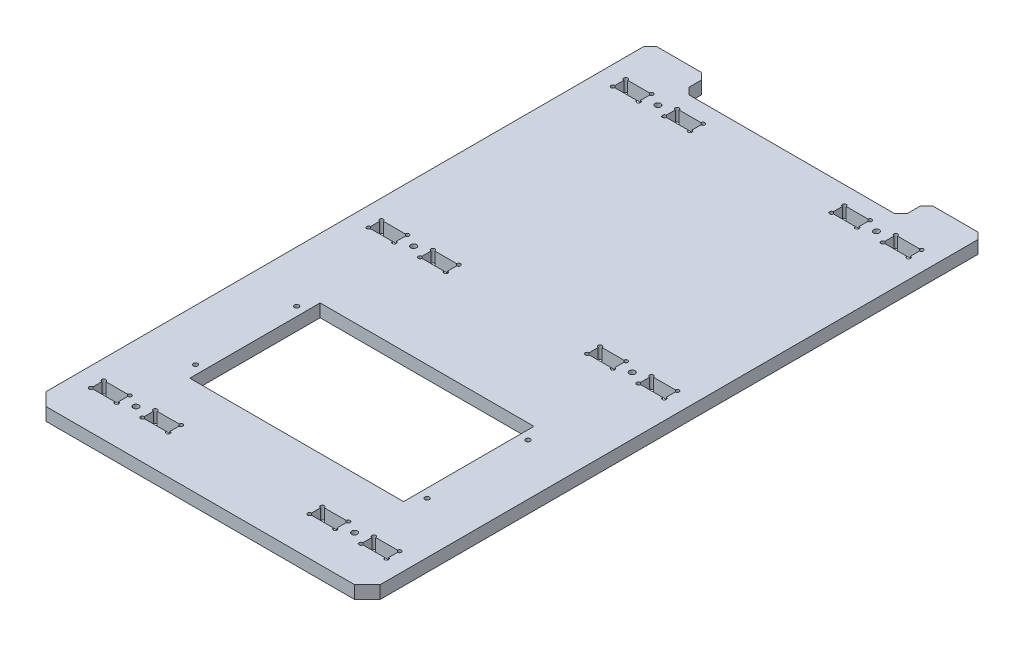
from build123d import *

# Parameters (mm, degrees)
SKETCH1_W            = 260
SKETCH1_H            = 440
EXTRUDE1_DEPTH       = 10
SKETCH3_W            = 260
SKETCH3_H            = 40
EXTRUDE3_DEPTH       = 10
SKETCH4_W            = 20
SKETCH4_H            = 10
CUT_EXTRUDE1_DEPTH   = 10
EXTRUDE4_DEPTH       = 10
MIRROR2_COPY_1_DEPTH = 10
MIRROR3_COPY_1_DEPTH = 10
MIRROR3_COPY_2_DEPTH = 10
MIRROR3_COPY_3_DEPTH = 10
MIRROR4_COPY_1_DEPTH = 10
MIRROR4_COPY_2_DEPTH = 10
MIRROR4_COPY_3_DEPTH = 10
M4_CLEARANCE_HOLE1_D = 4.5
SKETCH8_W            = 166.3
SKETCH8_H            = 101.4
CUT_EXTRUDE2_DEPTH   = 10
SKETCH9_R            = 1.75
CUT_EXTRUDE3_DEPTH   = 10
CHAMFER1_SIZE        = 10
SKETCH10_W           = 170
SKETCH10_H           = 20
EXTRUDE6_DEPTH       = 10
CHAMFER2_SIZE        = 5


with BuildPart() as part:
    # Sketch1 → Extrude1 (new body)
    with BuildSketch(Plane(origin=(0, 0, 0), x_dir=(1, 0, 0), z_dir=(0, 1, 0))):
        Rectangle(SKETCH1_W, SKETCH1_H)
    extrude(amount=EXTRUDE1_DEPTH)

    # Sketch3 → Extrude3 (add)
    with BuildSketch(Plane(origin=(0, 10, 0), x_dir=(1, 0, 0), z_dir=(0, 1, 0))):
        with Locations((0, 240)):
            Rectangle(SKETCH3_W, SKETCH3_H)
    extrude(amount=-EXTRUDE3_DEPTH)

    # Sketch4 → Cut-Extrude1 (cut)
    with BuildSketch(Plane(origin=(130, 0, -206), x_dir=(1, 0, 0), z_dir=(0, -1, 0))):
        with Locations((-235, 391)):
            Rectangle(SKETCH4_W, SKETCH4_H)
        with Locations((-195, 391)):
            Rectangle(SKETCH4_W, SKETCH4_H)
        with Locations((-65, 391)):
            Rectangle(SKETCH4_W, SKETCH4_H)
        with Locations((-25, 391)):
            Rectangle(SKETCH4_W, SKETCH4_H)
        with Locations((-235, 175)):
            Rectangle(SKETCH4_W, SKETCH4_H)
        with Locations((-195, 175)):
            Rectangle(SKETCH4_W, SKETCH4_H)
        with Locations((-65, 175)):
            Rectangle(SKETCH4_W, SKETCH4_H)
        with Locations((-25, 175)):
            Rectangle(SKETCH4_W, SKETCH4_H)
        with Locations((-235, -15)):
            Rectangle(SKETCH4_W, SKETCH4_H)
        with Locations((-195, -15)):
            Rectangle(SKETCH4_W, SKETCH4_H)
        with Locations((-65, -15)):
            Rectangle(SKETCH4_W, SKETCH4_H)
        with Locations((-25, -15)):
            Rectangle(SKETCH4_W, SKETCH4_H)
    extrude(amount=-CUT_EXTRUDE1_DEPTH, mode=Mode.SUBTRACT)

    # Sketch5 → Extrude4 (cut)
    with BuildSketch(Plane(origin=(0, 0, 0), x_dir=(-1, 0, 0), z_dir=(0, -1, 0))):
        with BuildLine():
            Line((96.5, -190), (95, -190))
            Line((95, -190), (95, -188.5))
            ThreePointArc((95, -188.5), (93.939339828, -191.060660172), (96.5, -190))
        make_face()
        with BuildLine():
            Line((115, -190), (113.5, -190))
            ThreePointArc((113.5, -190), (116.060660172, -191.060660172), (115, -188.5))
            Line((115, -188.5), (115, -190))
        make_face()
        with BuildLine():
            Line((115, -180), (113.5, -180))
            ThreePointArc((113.5, -180), (116.060660172, -178.939339828), (115, -181.5))
            Line((115, -181.5), (115, -180))
        make_face()
        with BuildLine():
            Line((96.5, -180), (95, -180))
            Line((95, -180), (95, -181.5))
            ThreePointArc((95, -181.5), (93.939339828, -178.939339828), (96.5, -180))
        make_face()
    extrude4 = extrude(amount=-EXTRUDE4_DEPTH, mode=Mode.SUBTRACT)

    # Mirror1: Extrude4 across plane
    add(extrude4.mirror(Plane(origin=(-85, 0, 0), x_dir=(0, 0, 1), z_dir=(1, 0, 0))), mode=Mode.SUBTRACT)

    # Mirror2: Extrude4 across plane
    add(extrude4.mirror(Plane(origin=(0, 0, 0), x_dir=(0, 0, 1), z_dir=(1, 0, 0))), mode=Mode.SUBTRACT)

    # Mirror2 copy 1 sketch → Mirror2 copy 1 (cut)
    with BuildSketch(Plane(origin=(170, 0, 0), x_dir=(-1, 0, 0), z_dir=(0, -1, 0))):
        with BuildLine():
            Line((96.5, -190), (95, -190))
            Line((95, -190), (95, -188.5))
            ThreePointArc((95, -188.5), (93.939339828, -191.060660172), (96.5, -190))
        make_face()
        with BuildLine():
            Line((115, -190), (113.5, -190))
            ThreePointArc((113.5, -190), (116.060660172, -191.060660172), (115, -188.5))
            Line((115, -188.5), (115, -190))
        make_face()
        with BuildLine():
            Line((115, -180), (113.5, -180))
            ThreePointArc((113.5, -180), (116.060660172, -178.939339828), (115, -181.5))
            Line((115, -181.5), (115, -180))
        make_face()
        with BuildLine():
            Line((96.5, -180), (95, -180))
            Line((95, -180), (95, -181.5))
            ThreePointArc((95, -181.5), (93.939339828, -178.939339828), (96.5, -180))
        make_face()
    extrude(amount=-MIRROR2_COPY_1_DEPTH, mode=Mode.SUBTRACT)

    # Mirror3: Extrude4 across plane
    add(extrude4.mirror(Plane(origin=(0, 0, 77), x_dir=(1, 0, 0), z_dir=(0, 0, -1))), mode=Mode.SUBTRACT)

    # Mirror3 copy 1 sketch → Mirror3 copy 1 (cut)
    with BuildSketch(Plane(origin=(-170, 0, 154), x_dir=(1, 0, 0), z_dir=(0, -1, 0))):
        with BuildLine():
            Line((96.5, -190), (95, -190))
            Line((95, -190), (95, -188.5))
            ThreePointArc((95, -188.5), (93.939339828, -191.060660172), (96.5, -190))
        make_face()
        with BuildLine():
            Line((115, -190), (113.5, -190))
            ThreePointArc((113.5, -190), (116.060660172, -191.060660172), (115, -188.5))
            Line((115, -188.5), (115, -190))
        make_face()
        with BuildLine():
            Line((115, -180), (113.5, -180))
            ThreePointArc((113.5, -180), (116.060660172, -178.939339828), (115, -181.5))
            Line((115, -181.5), (115, -180))
        make_face()
        with BuildLine():
            Line((96.5, -180), (95, -180))
            Line((95, -180), (95, -181.5))
            ThreePointArc((95, -181.5), (93.939339828, -178.939339828), (96.5, -180))
        make_face()
    extrude(amount=-MIRROR3_COPY_1_DEPTH, mode=Mode.SUBTRACT)

    # Mirror3 copy 2 sketch → Mirror3 copy 2 (cut)
    with BuildSketch(Plane(origin=(0, 0, 154), x_dir=(1, 0, 0), z_dir=(0, -1, 0))):
        with BuildLine():
            Line((96.5, -190), (95, -190))
            Line((95, -190), (95, -188.5))
            ThreePointArc((95, -188.5), (93.939339828, -191.060660172), (96.5, -190))
        make_face()
        with BuildLine():
            Line((115, -190), (113.5, -190))
            ThreePointArc((113.5, -190), (116.060660172, -191.060660172), (115, -188.5))
            Line((115, -188.5), (115, -190))
        make_face()
        with BuildLine():
            Line((115, -180), (113.5, -180))
            ThreePointArc((113.5, -180), (116.060660172, -178.939339828), (115, -181.5))
            Line((115, -181.5), (115, -180))
        make_face()
        with BuildLine():
            Line((96.5, -180), (95, -180))
            Line((95, -180), (95, -181.5))
            ThreePointArc((95, -181.5), (93.939339828, -178.939339828), (96.5, -180))
        make_face()
    extrude(amount=-MIRROR3_COPY_2_DEPTH, mode=Mode.SUBTRACT)

    # Mirror3 copy 3 sketch → Mirror3 copy 3 (cut)
    with BuildSketch(Plane(origin=(170, 0, 154), x_dir=(-1, 0, 0), z_dir=(0, -1, 0))):
        with BuildLine():
            Line((96.5, 190), (95, 190))
            Line((95, 190), (95, 188.5))
            ThreePointArc((95, 188.5), (93.939339828, 191.060660172), (96.5, 190))
        make_face()
        with BuildLine():
            Line((115, 190), (113.5, 190))
            ThreePointArc((113.5, 190), (116.060660172, 191.060660172), (115, 188.5))
            Line((115, 188.5), (115, 190))
        make_face()
        with BuildLine():
            Line((115, 180), (113.5, 180))
            ThreePointArc((113.5, 180), (116.060660172, 178.939339828), (115, 181.5))
            Line((115, 181.5), (115, 180))
        make_face()
        with BuildLine():
            Line((96.5, 180), (95, 180))
            Line((95, 180), (95, 181.5))
            ThreePointArc((95, 181.5), (93.939339828, 178.939339828), (96.5, 180))
        make_face()
    extrude(amount=-MIRROR3_COPY_3_DEPTH, mode=Mode.SUBTRACT)

    # Mirror4: Extrude4 across plane
    add(extrude4.mirror(Plane.XY.offset(-18)), mode=Mode.SUBTRACT)

    # Mirror4 copy 1 sketch → Mirror4 copy 1 (cut)
    with BuildSketch(Plane(origin=(-170, 0, -36), x_dir=(1, 0, 0), z_dir=(0, -1, 0))):
        with BuildLine():
            Line((96.5, -190), (95, -190))
            Line((95, -190), (95, -188.5))
            ThreePointArc((95, -188.5), (93.939339828, -191.060660172), (96.5, -190))
        make_face()
        with BuildLine():
            Line((115, -190), (113.5, -190))
            ThreePointArc((113.5, -190), (116.060660172, -191.060660172), (115, -188.5))
            Line((115, -188.5), (115, -190))
        make_face()
        with BuildLine():
            Line((115, -180), (113.5, -180))
            ThreePointArc((113.5, -180), (116.060660172, -178.939339828), (115, -181.5))
            Line((115, -181.5), (115, -180))
        make_face()
        with BuildLine():
            Line((96.5, -180), (95, -180))
            Line((95, -180), (95, -181.5))
            ThreePointArc((95, -181.5), (93.939339828, -178.939339828), (96.5, -180))
        make_face()
    extrude(amount=-MIRROR4_COPY_1_DEPTH, mode=Mode.SUBTRACT)

    # Mirror4 copy 2 sketch → Mirror4 copy 2 (cut)
    with BuildSketch(Plane(origin=(0, 0, -36), x_dir=(1, 0, 0), z_dir=(0, -1, 0))):
        with BuildLine():
            Line((96.5, -190), (95, -190))
            Line((95, -190), (95, -188.5))
            ThreePointArc((95, -188.5), (93.939339828, -191.060660172), (96.5, -190))
        make_face()
        with BuildLine():
            Line((115, -190), (113.5, -190))
            ThreePointArc((113.5, -190), (116.060660172, -191.060660172), (115, -188.5))
            Line((115, -188.5), (115, -190))
        make_face()
        with BuildLine():
            Line((115, -180), (113.5, -180))
            ThreePointArc((113.5, -180), (116.060660172, -178.939339828), (115, -181.5))
            Line((115, -181.5), (115, -180))
        make_face()
        with BuildLine():
            Line((96.5, -180), (95, -180))
            Line((95, -180), (95, -181.5))
            ThreePointArc((95, -181.5), (93.939339828, -178.939339828), (96.5, -180))
        make_face()
    extrude(amount=-MIRROR4_COPY_2_DEPTH, mode=Mode.SUBTRACT)

    # Mirror4 copy 3 sketch → Mirror4 copy 3 (cut)
    with BuildSketch(Plane(origin=(170, 0, -36), x_dir=(-1, 0, 0), z_dir=(0, -1, 0))):
        with BuildLine():
            Line((96.5, 190), (95, 190))
            Line((95, 190), (95, 188.5))
            ThreePointArc((95, 188.5), (93.939339828, 191.060660172), (96.5, 190))
        make_face()
        with BuildLine():
            Line((115, 190), (113.5, 190))
            ThreePointArc((113.5, 190), (116.060660172, 191.060660172), (115, 188.5))
            Line((115, 188.5), (115, 190))
        make_face()
        with BuildLine():
            Line((115, 180), (113.5, 180))
            ThreePointArc((113.5, 180), (116.060660172, 178.939339828), (115, 181.5))
            Line((115, 181.5), (115, 180))
        make_face()
        with BuildLine():
            Line((96.5, 180), (95, 180))
            Line((95, 180), (95, 181.5))
            ThreePointArc((95, 181.5), (93.939339828, 178.939339828), (96.5, 180))
        make_face()
    extrude(amount=-MIRROR4_COPY_3_DEPTH, mode=Mode.SUBTRACT)

    # M4 Clearance Hole1 (through all)
    with Locations(Plane(origin=(0, 10, 0), x_dir=(1, 0, 0), z_dir=(0, 1, 0))):
        with Locations((-85, 221), (85, 221), (85, 31), (-85, 31), (-85, -185), (85, -185)):
            Hole(M4_CLEARANCE_HOLE1_D / 2)

    # Sketch8 → Cut-Extrude2 (cut)
    with BuildSketch(Plane(origin=(130, 0, -206), x_dir=(1, 0, 0), z_dir=(0, -1, 0))):
        with Locations((-130, 300.3)):
            Rectangle(SKETCH8_W, SKETCH8_H)
    extrude(amount=-CUT_EXTRUDE2_DEPTH, mode=Mode.SUBTRACT)

    # Sketch9 → Cut-Extrude3 (cut)
    with BuildSketch(Plane(origin=(-103.5, 10, 155.65), x_dir=(-1, 0, 0), z_dir=(0, 1, 0))):
        with Locations(Location((-13.45, -22.05, 0), (0, 0, 90))):
            Circle(SKETCH9_R)
        with Locations(Location((-193.55, -22.05, 0), (0, 0, 90))):
            Circle(SKETCH9_R)
        with Locations(Location((-13.45, -100.65, 0), (0, 0, 90))):
            Circle(SKETCH9_R)
        with Locations(Location((-193.55, -100.55, 0), (0, 0, 90))):
            Circle(SKETCH9_R)
    extrude(amount=-CUT_EXTRUDE3_DEPTH, mode=Mode.SUBTRACT)

    # Chamfer1
    chamfer1_edges = [part.edges().sort_by_distance(p)[0] for p in [
        (130, 5, 220),
        (-130, 5, 220),
    ]]
    chamfer(chamfer1_edges, length=CHAMFER1_SIZE)

    # Sketch10 → Extrude6 (cut)
    with BuildSketch(Plane.XZ):
        with Locations((0, -250)):
            Rectangle(SKETCH10_W, SKETCH10_H)
    extrude(amount=-EXTRUDE6_DEPTH, mode=Mode.SUBTRACT)

    # Chamfer2
    chamfer2_edges = [part.edges().sort_by_distance(p)[0] for p in [
        (-130, 5, -260),
        (130, 5, -260),
        (-85, 5, -260),
        (-85, 5, -240),
        (85, 5, -240),
        (85, 5, -260),
    ]]
    chamfer(chamfer2_edges, length=CHAMFER2_SIZE)


solid = part.part
